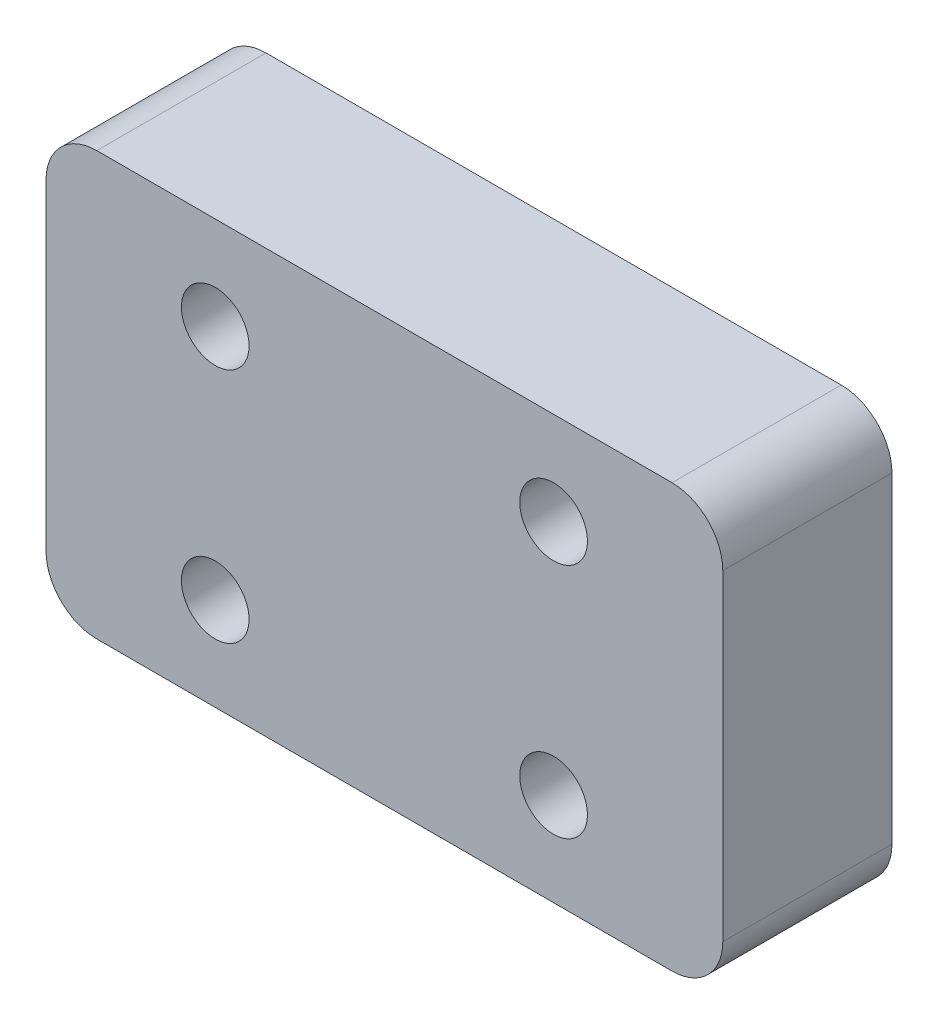
from build123d import *

# Parameters (mm, degrees)
EXTRUDE_1_DEPTH     = 10
CUT_EXTRUDE_1_REACH = 50.218
SKETCH_3_R          = 2


with BuildPart() as part:
    # 草图1 → 凸台-拉伸1 (new body)
    with BuildSketch(Plane.XY):
        with BuildLine():
            Line((-3, 0), (-37, 0))
            ThreePointArc((-37, 0), (-39.121320344, 0.878679656), (-40, 3))
            Line((-40, 3), (-40, 22))
            ThreePointArc((-40, 22), (-39.121320344, 24.121320344), (-37, 25))
            Line((-37, 25), (-3, 25))
            ThreePointArc((-3, 25), (-0.878679656, 24.121320344), (0, 22))
            Line((0, 22), (0, 3))
            ThreePointArc((0, 3), (-0.878679656, 0.878679656), (-3, 0))
        make_face()
    extrude(amount=EXTRUDE_1_DEPTH)

    # 草图3 → 切除-拉伸1 (cut, up to next)
    with BuildSketch(Plane.XY.offset(10), mode=Mode.PRIVATE) as cut_extrude_1_sk1:
        with Locations((-30, 19.5)):
            Circle(SKETCH_3_R)
    cut_extrude_1_tool1 = extrude(cut_extrude_1_sk1.sketch, amount=-CUT_EXTRUDE_1_REACH, mode=Mode.PRIVATE) & part.part
    # 草图3 → 切除-拉伸1 (cut, up to next)
    with BuildSketch(Plane.XY.offset(10), mode=Mode.PRIVATE) as cut_extrude_1_sk2:
        with Locations(Location((-30, 5.5, 0), (0, 0, 180))):
            Circle(SKETCH_3_R)
    cut_extrude_1_tool2 = extrude(cut_extrude_1_sk2.sketch, amount=-CUT_EXTRUDE_1_REACH, mode=Mode.PRIVATE) & part.part
    # 草图3 → 切除-拉伸1 (cut, up to next)
    with BuildSketch(Plane.XY.offset(10), mode=Mode.PRIVATE) as cut_extrude_1_sk3:
        with Locations(Location((-10, 19.5, 0), (0, 0, 180))):
            Circle(SKETCH_3_R)
    cut_extrude_1_tool3 = extrude(cut_extrude_1_sk3.sketch, amount=-CUT_EXTRUDE_1_REACH, mode=Mode.PRIVATE) & part.part
    # 草图3 → 切除-拉伸1 (cut, up to next)
    with BuildSketch(Plane.XY.offset(10), mode=Mode.PRIVATE) as cut_extrude_1_sk4:
        with Locations((-10, 5.5)):
            Circle(SKETCH_3_R)
    cut_extrude_1_tool4 = extrude(cut_extrude_1_sk4.sketch, amount=-CUT_EXTRUDE_1_REACH, mode=Mode.PRIVATE) & part.part
    add(cut_extrude_1_tool1.solids().sort_by_distance((-30, 19.5, 10))[0], mode=Mode.SUBTRACT)
    add(cut_extrude_1_tool2.solids().sort_by_distance((-30, 5.5, 10))[0], mode=Mode.SUBTRACT)
    add(cut_extrude_1_tool3.solids().sort_by_distance((-10, 19.5, 10))[0], mode=Mode.SUBTRACT)
    add(cut_extrude_1_tool4.solids().sort_by_distance((-10, 5.5, 10))[0], mode=Mode.SUBTRACT)


solid = part.part
